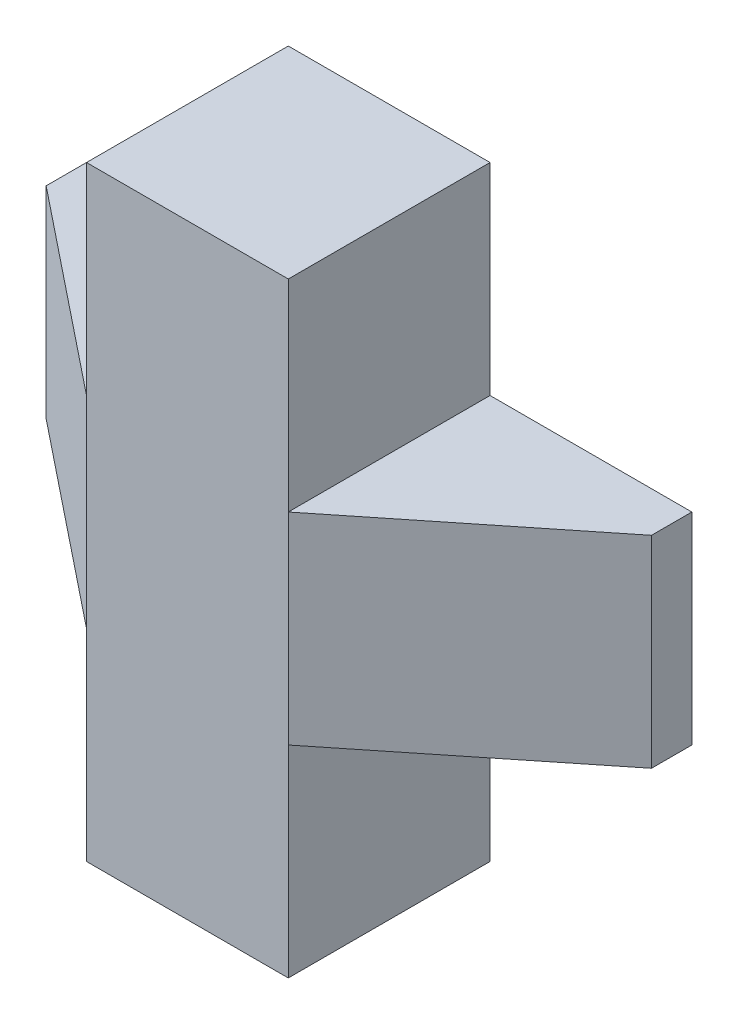
from build123d import *

# Parameters (mm, degrees)
SKETCH1_W           = 150
SKETCH1_H           = 150
BOSS_EXTRUDE1_DEPTH = 50
SKETCH2_W           = 50
SKETCH2_H           = 50
CUT_EXTRUDE1_DEPTH  = 50
CUT_EXTRUDE2_DEPTH  = 50


with BuildPart() as part:
    # Sketch1 → Boss-Extrude1 (new body)
    with BuildSketch(Plane.XY):
        Rectangle(SKETCH1_W, SKETCH1_H)
    extrude(amount=BOSS_EXTRUDE1_DEPTH)

    # Sketch2 → Cut-Extrude1 (cut)
    with BuildSketch(Plane.XY.offset(50)):
        with Locations((-50, 50)):
            Rectangle(SKETCH2_W, SKETCH2_H)
        with Locations((50, 50)):
            Rectangle(SKETCH2_W, SKETCH2_H)
        with Locations((50, -50)):
            Rectangle(SKETCH2_W, SKETCH2_H)
        with Locations((-50, -50)):
            Rectangle(SKETCH2_W, SKETCH2_H)
    extrude(amount=-CUT_EXTRUDE1_DEPTH, mode=Mode.SUBTRACT)

    # Sketch3 → Cut-Extrude2 (cut)
    with BuildSketch(Plane(origin=(0, 25, 0), x_dir=(1, 0, 0), z_dir=(0, 1, 0))):
        Polygon((25, -50), (75, -10), (75, -50), align=None)
        Polygon((-75, -10), (-75, -50), (-25, -50), align=None)
    extrude(amount=-CUT_EXTRUDE2_DEPTH, mode=Mode.SUBTRACT)


solid = part.part
